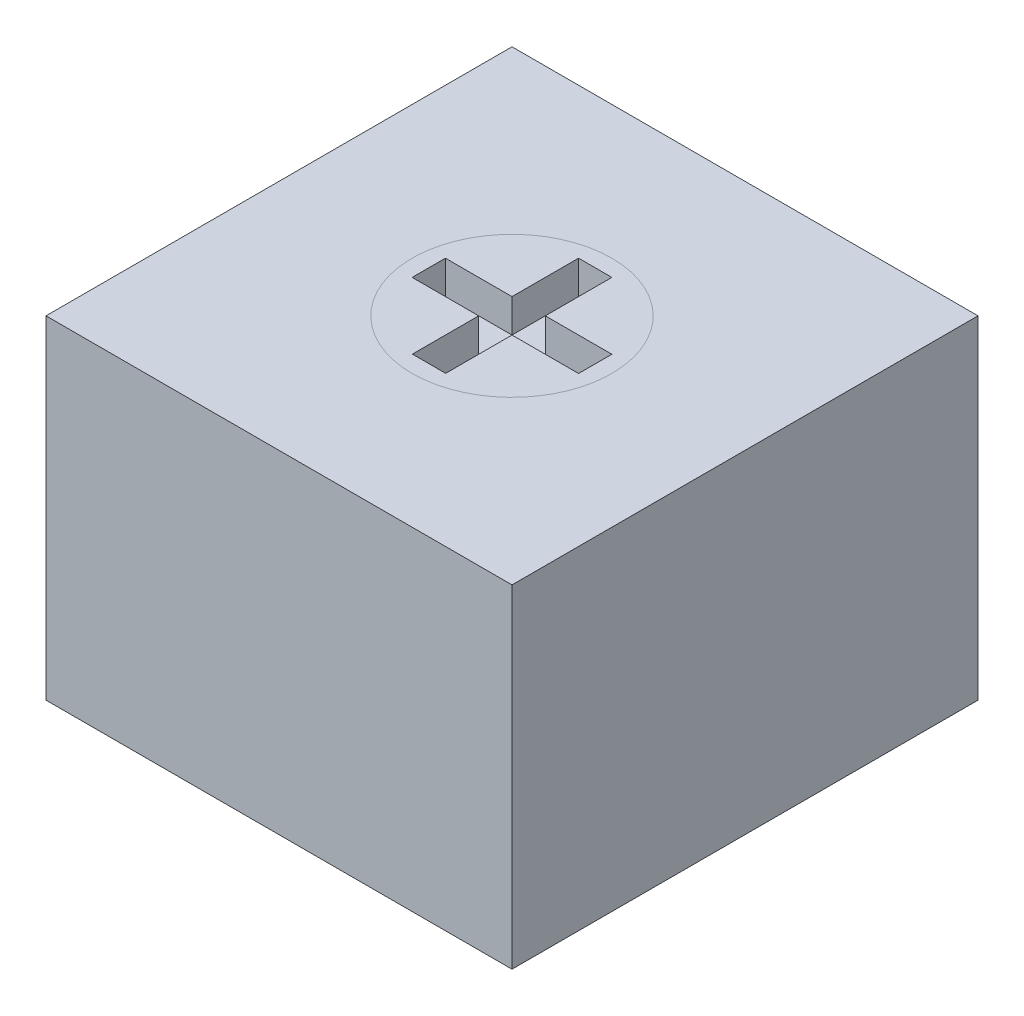
from build123d import *

# Parameters (mm, degrees)
SKETCH_1_W          = 7
SKETCH_1_H          = 7
EXTRUDE_1_DEPTH     = 5
SKETCH_2_R          = 1.5
CUT_EXTRUDE_1_DEPTH = 3
SKETCH_3_R          = 1.5
EXTRUDE_2_DEPTH     = 3
CUT_EXTRUDE_2_DEPTH = 0.5


with BuildPart() as part:
    # 草图1 → 凸台-拉伸1 (new body)
    with BuildSketch(Plane(origin=(0, 0, 0), x_dir=(1, 0, 0), z_dir=(0, 1, 0))):
        with Locations((-16.338382139, 14.040032989)):
            Rectangle(SKETCH_1_W, SKETCH_1_H)
    extrude(amount=EXTRUDE_1_DEPTH)

    # 草图2 → 切除-拉伸1 (cut)
    with BuildSketch(Plane(origin=(0, 5, 0), x_dir=(1, 0, 0), z_dir=(0, 1, 0))):
        with Locations(Location((-16.338382139, 14.040032989, 0), (0, 0, 270))):
            Circle(SKETCH_2_R)
    extrude(amount=-CUT_EXTRUDE_1_DEPTH, mode=Mode.SUBTRACT)


with BuildPart() as body_2:
    # 草图3 → 凸台-拉伸2 (new body)
    with BuildSketch(Plane(origin=(0, 2, 0), x_dir=(1, 0, 0), z_dir=(0, 1, 0))):
        with Locations(Location((-16.338382139, 14.040032989, 0), (0, 0, 270))):
            Circle(SKETCH_3_R)
    extrude(amount=EXTRUDE_2_DEPTH)

    # 草图4 → 切除-拉伸2 (cut)
    with BuildSketch(Plane(origin=(0, 5, 0), x_dir=(1, 0, 0), z_dir=(0, 1, 0))):
        Polygon((-17.588382139, 14.290032989), (-16.588382139, 14.290032989), (-16.588382139, 15.290032989), (-16.088382139, 15.290032989), (-16.088382139, 14.290032989), (-15.088382139, 14.290032989), (-15.088382139, 13.790032989), (-16.088382139, 13.790032989), (-16.088382139, 12.79384017), (-16.588382139, 12.79384017), (-16.588382139, 13.790032989), (-17.588382139, 13.790032989), align=None)
    extrude(amount=-CUT_EXTRUDE_2_DEPTH, mode=Mode.SUBTRACT)


solid = Compound([part.part, body_2.part])
